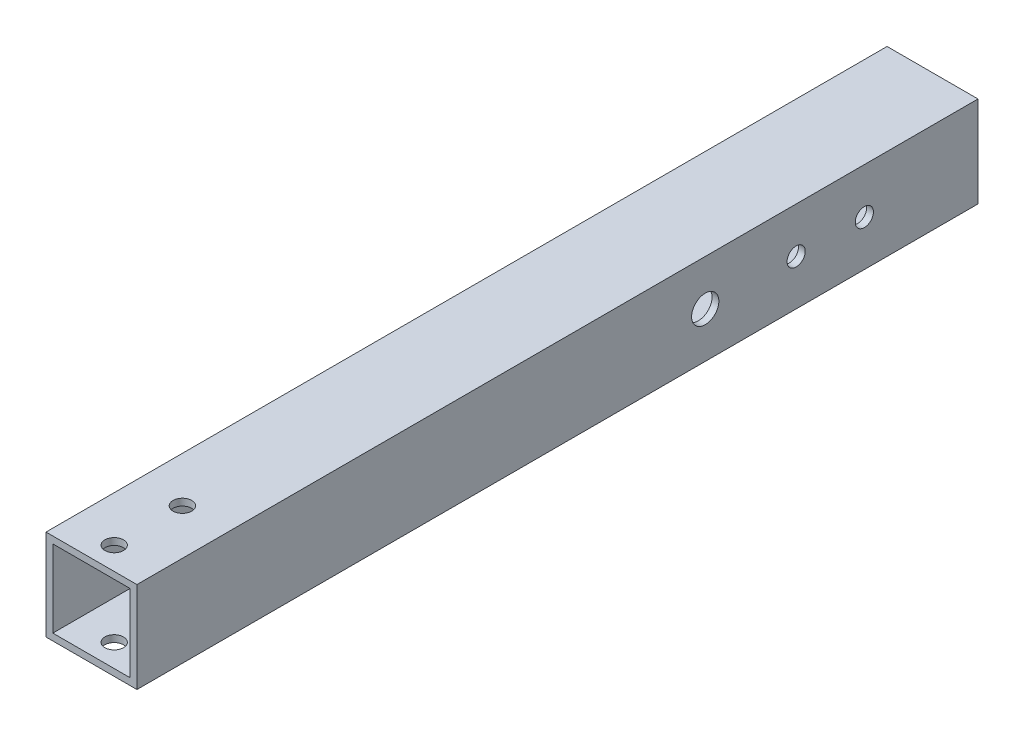
from build123d import *

# Parameters (mm, degrees)
SKETCH_1_W          = 20
SKETCH_1_H          = 20
SKETCH_1_W_2        = 17
SKETCH_1_H_2        = 17
EXTRUDE_1_DEPTH     = 185
SKETCH_2_R          = 2.05
CUT_EXTRUDE_1_DEPTH = 187.346451536
SKETCH_3_R          = 2
CUT_EXTRUDE_2_DEPTH = 187.346451536
SKETCH_4_R          = 3
CUT_EXTRUDE_3_DEPTH = 187.346451536


with BuildPart() as part:
    # 草图1 → 凸台-拉伸1 (new body)
    with BuildSketch(Plane.XY):
        Rectangle(SKETCH_1_W, SKETCH_1_H)
        Rectangle(SKETCH_1_W_2, SKETCH_1_H_2, mode=Mode.SUBTRACT)
    extrude(amount=EXTRUDE_1_DEPTH)

    # 草图2 → 切除-拉伸1 (cut, through all)
    with BuildSketch(Plane(origin=(0, 10, 0), x_dir=(1, 0, 0), z_dir=(0, 1, 0))):
        with Locations(Location((0, -180, 0), (0, 0, 270))):
            Circle(SKETCH_2_R)
        with Locations(Location((0, -165, 0), (0, 0, 270))):
            Circle(SKETCH_2_R)
    extrude(amount=-CUT_EXTRUDE_1_DEPTH, mode=Mode.SUBTRACT)

    # 草图3 → 切除-拉伸2 (cut, through all)
    with BuildSketch(Plane(origin=(10, 0, 0), x_dir=(0, 0, -1), z_dir=(1, 0, 0))):
        with Locations(Location((-25, 0, 0), (0, 0, 90))):
            Circle(SKETCH_3_R)
        with Locations(Location((-40, 0, 0), (0, 0, 90))):
            Circle(SKETCH_3_R)
    extrude(amount=-CUT_EXTRUDE_2_DEPTH, mode=Mode.SUBTRACT)

    # 草图4 → 切除-拉伸3 (cut, through all)
    with BuildSketch(Plane.ZY.offset(10)):
        with Locations((60, 0)):
            Circle(SKETCH_4_R)
    extrude(amount=-CUT_EXTRUDE_3_DEPTH, mode=Mode.SUBTRACT)


solid = part.part
